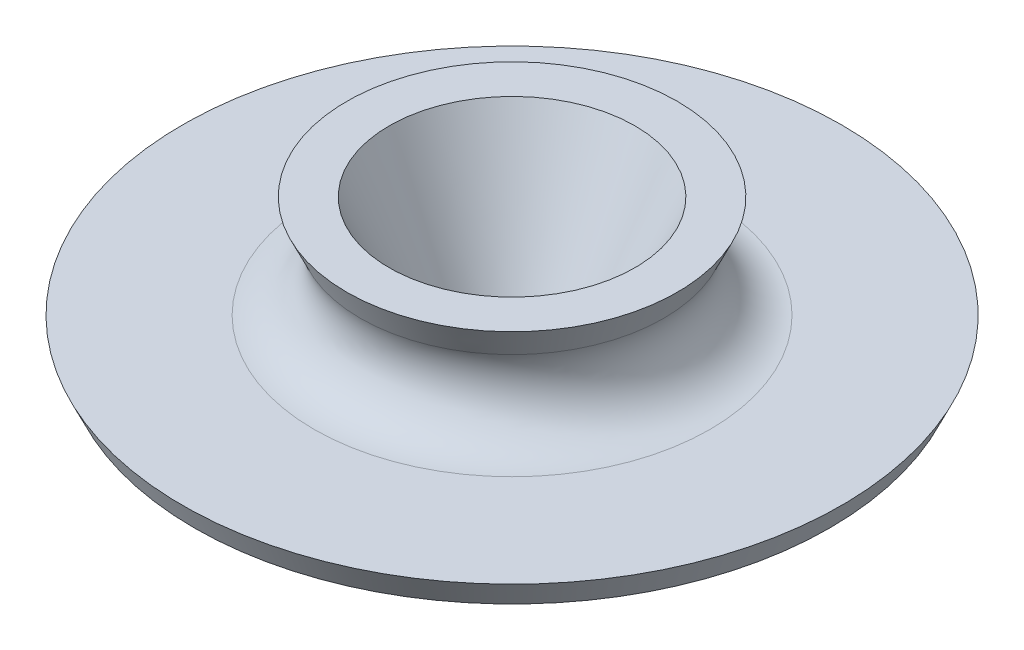
from build123d import *

# Parameters (mm, degrees)
FILLET2_R = 12.7
FILLET3_R = 2.54


with BuildPart() as part:
    # Sketch1 → Revolve2 (revolve)
    with BuildSketch(Plane.XY, mode=Mode.PRIVATE) as revolve2_sk:
        Polygon((-12.7, -0.571707157), (-30.466321776, 37.528292843), (-40.975996454, 37.528292843), (-29.131781937, 12.128292843), (-50.190671319, 12.128292843), (-81.680155327, 12.128292843), (-78.719101698, 5.778292843), (-22.011053629, 5.778292843), (-19.05, -0.571707157), align=None)
    revolve(revolve2_sk.sketch.rotate(Axis((0, 0, 0), (0, 1, 0)), 270), axis=Axis((0, 0, 0), (0, 1, 0)))

    # Fillet2
    fillet2_edges = [part.edges().sort_by_distance(p)[0] for p in [
        (0, 12.128292843, 29.131781937),
    ]]
    fillet(fillet2_edges, radius=FILLET2_R)

    # Fillet3
    fillet3_edges = [part.edges().sort_by_distance(p)[0] for p in [
        (0, 5.778292843, 22.011053629),
    ]]
    fillet(fillet3_edges, radius=FILLET3_R)


solid = part.part
